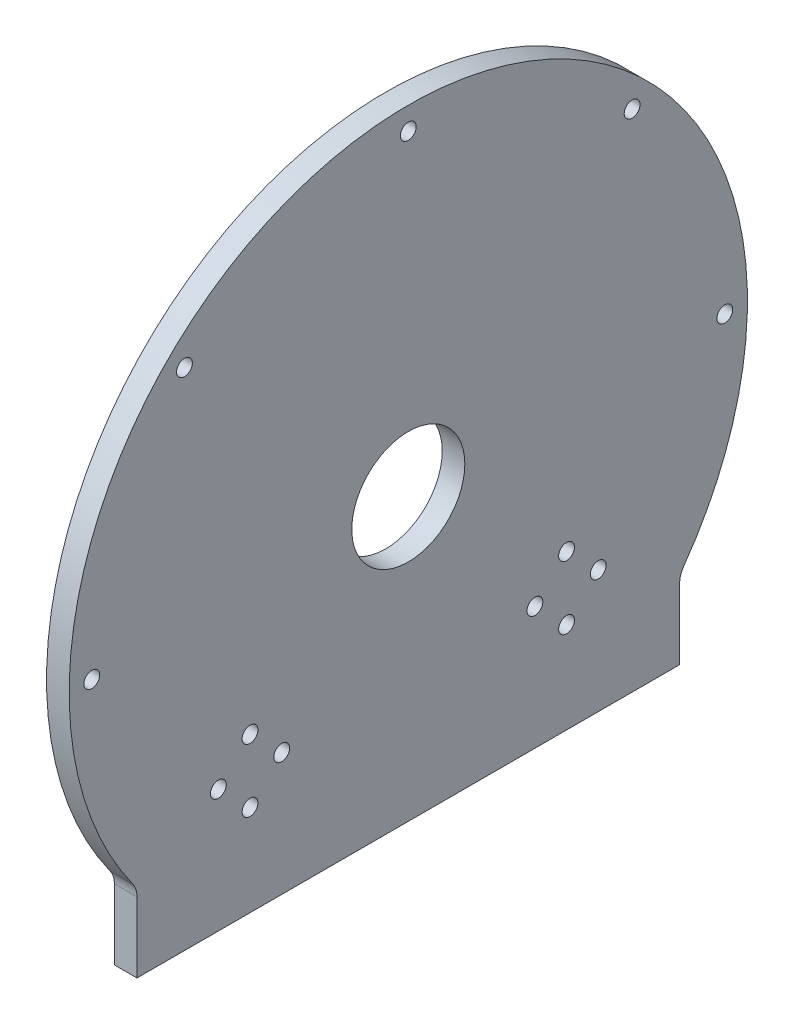
from build123d import *

# Parameters (mm, degrees)
SKETCH_1_R          = 12.5
SKETCH_1_R_2        = 1.75
EXTRUDE_1_DEPTH     = 5
FILLET_1_R          = 5
SKETCH_3_R          = 1.1
CUT_EXTRUDE_2_DEPTH = 10
SKETCH_4_R          = 1.5
CUT_EXTRUDE_3_DEPTH = 10
EXTRUDE2_DEPTH      = 311.885831134
EXTRUDE2_DEPTH_BACK = 311.885831134


with BuildPart() as part:
    # 草图1 → 凸台-拉伸1 (new body)
    with BuildSketch(Plane(origin=(0, 0, 0), x_dir=(0, 0, -1), z_dir=(1, 0, 0))):
        with BuildLine():
            Line((0, 0), (0, 160))
            ThreePointArc((0, 160), (60, 280), (120, 160))
            Line((120, 160), (120, 0))
            Line((120, 0), (0, 0))
        make_face()
        with Locations((60, 205)):
            Circle(SKETCH_1_R, mode=Mode.SUBTRACT)
        with Locations((25, 177)):
            Circle(SKETCH_1_R_2, mode=Mode.SUBTRACT)
        with Locations((32, 170)):
            Circle(SKETCH_1_R_2, mode=Mode.SUBTRACT)
        with Locations((25, 163)):
            Circle(SKETCH_1_R_2, mode=Mode.SUBTRACT)
        with Locations((18, 170)):
            Circle(SKETCH_1_R_2, mode=Mode.SUBTRACT)
        with Locations((95, 177)):
            Circle(SKETCH_1_R_2, mode=Mode.SUBTRACT)
        with Locations((102, 170)):
            Circle(SKETCH_1_R_2, mode=Mode.SUBTRACT)
        with Locations((95, 163)):
            Circle(SKETCH_1_R_2, mode=Mode.SUBTRACT)
        with Locations((88, 170)):
            Circle(SKETCH_1_R_2, mode=Mode.SUBTRACT)
        with Locations((39, 140)):
            Circle(SKETCH_1_R_2, mode=Mode.SUBTRACT)
        with Locations((81, 140)):
            Circle(SKETCH_1_R_2, mode=Mode.SUBTRACT)
        with Locations((60, 275)):
            Circle(SKETCH_1_R_2, mode=Mode.SUBTRACT)
        with Locations((-10, 205)):
            Circle(SKETCH_1_R_2, mode=Mode.SUBTRACT)
        with Locations((130, 205)):
            Circle(SKETCH_1_R_2, mode=Mode.SUBTRACT)
        with Locations((10.502525317, 254.497474683)):
            Circle(SKETCH_1_R_2, mode=Mode.SUBTRACT)
        with Locations((109.497474683, 254.497474683)):
            Circle(SKETCH_1_R_2, mode=Mode.SUBTRACT)
        with Locations((5, 5)):
            Circle(SKETCH_1_R_2, mode=Mode.SUBTRACT)
        with Locations((115, 5)):
            Circle(SKETCH_1_R_2, mode=Mode.SUBTRACT)
        with Locations((5, 120)):
            Circle(SKETCH_1_R_2, mode=Mode.SUBTRACT)
        with Locations((115, 120)):
            Circle(SKETCH_1_R_2, mode=Mode.SUBTRACT)
        with BuildLine():
            Line((40.5, 81), (40.5, 59))
            ThreePointArc((40.5, 59), (39, 57.5), (37.5, 59))
            Line((37.5, 59), (37.5, 81))
            ThreePointArc((37.5, 81), (39, 82.5), (40.5, 81))
        make_face(mode=Mode.SUBTRACT)
        with BuildLine():
            Line((79.5, 81), (79.5, 59))
            ThreePointArc((79.5, 59), (81, 57.5), (82.5, 59))
            Line((82.5, 59), (82.5, 81))
            ThreePointArc((82.5, 81), (81, 82.5), (79.5, 81))
        make_face(mode=Mode.SUBTRACT)
    extrude(amount=EXTRUDE_1_DEPTH)

    # 圆角1
    fillet_1_edges = [part.edges().sort_by_distance(p)[0] for p in [
        (2.5, 0, 0),
        (2.5, 160, 0),
        (2.5, 160, -120),
        (2.5, 0, -120),
    ]]
    fillet(fillet_1_edges, radius=FILLET_1_R)

    # 草图3 → 切除-拉伸2 (cut)
    with BuildSketch(Plane.ZY):
        with Locations((-45.818141739, 127.45827935)):
            Circle(SKETCH_3_R)
        with Locations((-61.818141739, 127.45827935)):
            Circle(SKETCH_3_R)
        with Locations((-45.818141739, 91.45827935)):
            Circle(SKETCH_3_R)
        with Locations((-61.818141739, 91.45827935)):
            Circle(SKETCH_3_R)
        with BuildLine():
            Line((-20, 46.75), (-30, 46.75))
            ThreePointArc((-30, 46.75), (-31.75, 48.5), (-30, 50.25))
            Line((-30, 50.25), (-20, 50.25))
            ThreePointArc((-20, 50.25), (-18.25, 48.5), (-20, 46.75))
        make_face()
        with BuildLine():
            Line((-90, 46.75), (-100, 46.75))
            ThreePointArc((-100, 46.75), (-101.75, 48.5), (-100, 50.25))
            Line((-100, 50.25), (-90, 50.25))
            ThreePointArc((-90, 50.25), (-88.25, 48.5), (-90, 46.75))
        make_face()
        with BuildLine():
            Line((-20, 8.25), (-30, 8.25))
            ThreePointArc((-30, 8.25), (-31.75, 10), (-30, 11.75))
            Line((-30, 11.75), (-20, 11.75))
            ThreePointArc((-20, 11.75), (-18.25, 10), (-20, 8.25))
        make_face()
        with BuildLine():
            Line((-90, 8.25), (-100, 8.25))
            ThreePointArc((-100, 8.25), (-101.75, 10), (-100, 11.75))
            Line((-100, 11.75), (-90, 11.75))
            ThreePointArc((-90, 11.75), (-88.25, 10), (-90, 8.25))
        make_face()
    extrude(amount=-CUT_EXTRUDE_2_DEPTH, mode=Mode.SUBTRACT)

    # 草图4 → 切除-拉伸3 (cut)
    with BuildSketch(Plane.ZY):
        with Locations((-16.118918229, 88.740617872)):
            Circle(SKETCH_4_R)
        with Locations((-16.118918229, 64.240617872)):
            Circle(SKETCH_4_R)
        with Locations((-94, 140)):
            Circle(SKETCH_4_R)
        with Locations((-26, 140)):
            Circle(SKETCH_4_R)
        with Locations((-94, 82)):
            Circle(SKETCH_4_R)
        with Locations((-26, 82)):
            Circle(SKETCH_4_R)
    extrude(amount=-CUT_EXTRUDE_3_DEPTH, mode=Mode.SUBTRACT)

    # Sketch1 → Extrude2 (cut, two sides: drawn at the far end of the back side and taken through both)
    with BuildSketch(Plane.ZY.offset(-EXTRUDE2_DEPTH_BACK)):
        Polygon((-523.056193456, 142.822592063), (-120, 142.822592063), (0, 142.822592063), (403.056193456, 142.822592063), (403.056193456, -663.289794849), (-523.056193456, -663.289794849), align=None)
    extrude(amount=EXTRUDE2_DEPTH + EXTRUDE2_DEPTH_BACK, mode=Mode.SUBTRACT)


solid = part.part
